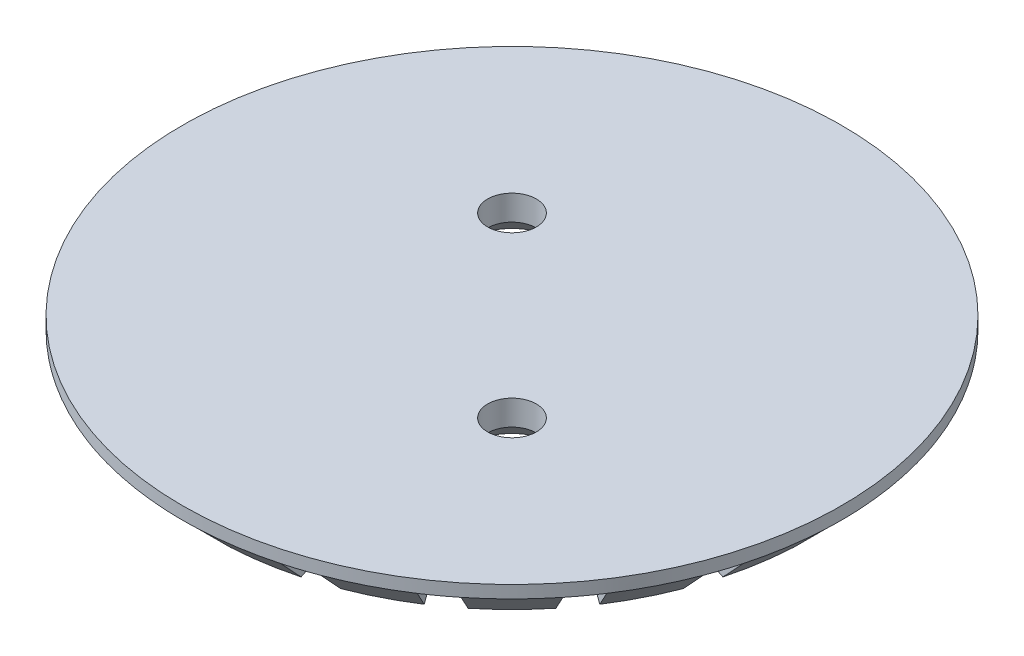
from build123d import *

# Parameters (mm, degrees)
SKETCH2_R                                         = 21
SKETCH2_R_2                                       = 7.5
BOSS_EXTRUDE1_DEPTH                               = 2.8
CSK_FOR_M2_5_FLAT_HEAD_MACHINE_SCREW1_D           = 3.1
CSK_FOR_M2_5_FLAT_HEAD_MACHINE_SCREW1_CSINK_D     = 5.5
CSK_FOR_M2_5_FLAT_HEAD_MACHINE_SCREW1_CSINK_ANGLE = 90
CHAMFER1_SIZE                                     = 2
CUT_EXTRUDE1_DEPTH                                = 2


with BuildPart() as part:
    # Sketch2 → Boss-Extrude1 (new body)
    # profile 1 of 3: a face of its own
    with BuildSketch(Plane(origin=(0, 0, 0), x_dir=(1, 0, 0), z_dir=(0, 1, 0))):
        with Locations(Location((31.941171231, -2.886996739, 0), (0, 0, 270))):
            Circle(SKETCH2_R)
        with Locations((22.748783076, -12.079384894)):
            Circle(SKETCH2_R_2, mode=Mode.SUBTRACT)
        with Locations((41.133559387, 6.305391417)):
            Circle(SKETCH2_R_2, mode=Mode.SUBTRACT)
    # profile 2 of 3: a face of its own
    with BuildSketch(Plane(origin=(0, 0, 0), x_dir=(1, 0, 0), z_dir=(0, 1, 0))):
        with Locations((22.748783076, -12.079384894)):
            Circle(SKETCH2_R_2)
    # profile 3 of 3: a face of its own
    with BuildSketch(Plane(origin=(0, 0, 0), x_dir=(1, 0, 0), z_dir=(0, 1, 0))):
        with Locations((41.133559387, 6.305391417)):
            Circle(SKETCH2_R_2)
    extrude(amount=BOSS_EXTRUDE1_DEPTH)

    # CSK for M2.5 Flat Head Machine Screw1 (through all)
    with Locations(Plane.XZ):
        with Locations((26.284316982, -2.769857511), (37.598025481, 8.543850988)):
            CounterSinkHole(CSK_FOR_M2_5_FLAT_HEAD_MACHINE_SCREW1_D / 2, CSK_FOR_M2_5_FLAT_HEAD_MACHINE_SCREW1_CSINK_D / 2, counter_sink_angle=CSK_FOR_M2_5_FLAT_HEAD_MACHINE_SCREW1_CSINK_ANGLE)

    # Chamfer1
    chamfer1_edges = [part.edges().sort_by_distance(p)[0] for p in [
        (31.941171231, 0, -18.113003261),
    ]]
    chamfer(chamfer1_edges, length=CHAMFER1_SIZE)

    # Sketch5 → Cut-Extrude1 (cut)
    with BuildSketch(Plane.XZ):
        with BuildLine():
            Line((19.291076579, -0.171805949), (13.587125587, -2.025131973))
            ThreePointArc((13.587125587, -2.025131973), (13.871097422, -2.984326154), (14.205159576, -3.927245005))
            Line((14.205159576, -3.927245005), (19.909110568, -2.073918981))
            Line((19.909110568, -2.073918981), (19.291076579, -0.171805949))
        make_face()
        with BuildLine():
            Line((20.855438294, -3.931191717), (16.003367771, -7.456427301))
            ThreePointArc((16.003367771, -7.456427301), (16.569848338, -8.280923055), (17.178938276, -9.07446129))
            Line((17.178938276, -9.07446129), (22.031008798, -5.549225706))
            Line((22.031008798, -5.549225706), (20.855438294, -3.931191717))
        make_face()
        with BuildLine():
            Line((23.504948787, -7.023165694), (19.979713203, -11.875236217))
            ThreePointArc((19.979713203, -11.875236217), (20.773251438, -12.484326154), (21.597747192, -13.050806722))
            Line((21.597747192, -13.050806722), (25.122982776, -8.198736199))
            Line((25.122982776, -8.198736199), (23.504948787, -7.023165694))
        make_face()
        with BuildLine():
            Line((19.979713203, -11.875236217), (18.802666769, -13.495301649))
            ThreePointArc((18.802666769, -13.495301649), (19.597680933, -14.102360143), (20.420700757, -14.670872154))
            Line((20.420700757, -14.670872154), (21.597747192, -13.050806722))
            ThreePointArc((21.597747192, -13.050806722), (20.773251438, -12.484326154), (19.979713203, -11.875236217))
        make_face()
        with BuildLine():
            Line((25.126929488, -14.849014917), (24.508119556, -16.753516055))
            ThreePointArc((24.508119556, -16.753516055), (25.45181435, -17.085190104), (26.410232589, -17.371550044))
            Line((26.410232589, -17.371550044), (27.02904252, -15.467048906))
            ThreePointArc((27.02904252, -15.467048906), (26.069848338, -15.183077071), (25.126929488, -14.849014917))
        make_face()
        with BuildLine():
            Line((26.980255511, -9.145063925), (25.126929488, -14.849014917))
            ThreePointArc((25.126929488, -14.849014917), (26.069848338, -15.183077071), (27.02904252, -15.467048906))
            Line((27.02904252, -15.467048906), (28.882368544, -9.763097913))
            Line((28.882368544, -9.763097913), (26.980255511, -9.145063925))
        make_face()
        with BuildLine():
            Line((30.941171231, -10.089180225), (30.941171231, -16.086669222))
            ThreePointArc((30.941171231, -16.086669222), (31.941171231, -16.113003261), (32.941171231, -16.086669222))
            Line((32.941171231, -16.086669222), (32.941171231, -10.089180225))
            Line((32.941171231, -10.089180225), (30.941171231, -10.089180225))
        make_face()
        with BuildLine():
            Line((30.941171231, -16.086669222), (30.941171231, -18.089180225))
            ThreePointArc((30.941171231, -18.089180225), (31.941171231, -18.113003261), (32.941171231, -18.089180225))
            Line((32.941171231, -18.089180225), (32.941171231, -16.086669222))
            ThreePointArc((32.941171231, -16.086669222), (31.941171231, -16.113003261), (30.941171231, -16.086669222))
        make_face()
        with BuildLine():
            ThreePointArc((36.853299943, -15.467048906), (37.812494125, -15.183077071), (38.755412975, -14.849014917))
            Line((38.755412975, -14.849014917), (36.902086951, -9.145063925))
            Line((36.902086951, -9.145063925), (34.999973919, -9.763097913))
            Line((34.999973919, -9.763097913), (36.853299943, -15.467048906))
        make_face()
        with BuildLine():
            ThreePointArc((37.472109874, -17.371550044), (38.430528113, -17.085190104), (39.374222906, -16.753516055))
            Line((39.374222906, -16.753516055), (38.755412975, -14.849014917))
            ThreePointArc((38.755412975, -14.849014917), (37.812494125, -15.183077071), (36.853299943, -15.467048906))
            Line((36.853299943, -15.467048906), (37.472109874, -17.371550044))
        make_face()
        with BuildLine():
            ThreePointArc((42.284595271, -13.050806722), (43.109091025, -12.484326154), (43.90262926, -11.875236217))
            Line((43.90262926, -11.875236217), (40.377393676, -7.023165694))
            Line((40.377393676, -7.023165694), (38.759359687, -8.198736199))
            Line((38.759359687, -8.198736199), (42.284595271, -13.050806722))
        make_face()
        with BuildLine():
            ThreePointArc((43.461641706, -14.670872154), (44.28466153, -14.102360143), (45.079675694, -13.495301649))
            Line((45.079675694, -13.495301649), (43.90262926, -11.875236217))
            ThreePointArc((43.90262926, -11.875236217), (43.109091025, -12.484326154), (42.284595271, -13.050806722))
            Line((42.284595271, -13.050806722), (43.461641706, -14.670872154))
        make_face()
        with BuildLine():
            ThreePointArc((46.703404187, -9.07446129), (47.312494125, -8.280923055), (47.878974692, -7.456427301))
            Line((47.878974692, -7.456427301), (43.026904169, -3.931191717))
            Line((43.026904169, -3.931191717), (41.851333665, -5.549225706))
            Line((41.851333665, -5.549225706), (46.703404187, -9.07446129))
        make_face()
        with BuildLine():
            ThreePointArc((48.32346962, -10.251507724), (48.930528113, -9.456493559), (49.499040124, -8.633473736))
            Line((49.499040124, -8.633473736), (47.878974692, -7.456427301))
            ThreePointArc((47.878974692, -7.456427301), (47.312494125, -8.280923055), (46.703404187, -9.07446129))
            Line((46.703404187, -9.07446129), (48.32346962, -10.251507724))
        make_face()
        with BuildLine():
            ThreePointArc((49.677182887, -3.927245005), (50.011245041, -2.984326154), (50.295216876, -2.025131973))
            Line((50.295216876, -2.025131973), (44.591265883, -0.171805949))
            Line((44.591265883, -0.171805949), (43.973231895, -2.073918981))
            Line((43.973231895, -2.073918981), (49.677182887, -3.927245005))
        make_face()
        with BuildLine():
            ThreePointArc((51.581684025, -4.546054936), (51.913358074, -3.602360143), (52.199718014, -2.643941904))
            Line((52.199718014, -2.643941904), (50.295216876, -2.025131973))
            ThreePointArc((50.295216876, -2.025131973), (50.011245041, -2.984326154), (49.677182887, -3.927245005))
            Line((49.677182887, -3.927245005), (51.581684025, -4.546054936))
        make_face()
        with BuildLine():
            ThreePointArc((52.941171231, 2.886996739), (52.935214628, 3.387138603), (52.917348195, 3.886996739))
            Line((52.917348195, 3.886996739), (50.914837192, 3.886996739))
            ThreePointArc((50.914837192, 3.886996739), (50.934586581, 3.387170079), (50.941171231, 2.886996739))
            ThreePointArc((50.941171231, 2.886996739), (50.934586581, 2.386823398), (50.914837192, 1.886996739))
            Line((50.914837192, 1.886996739), (52.917348195, 1.886996739))
            ThreePointArc((52.917348195, 1.886996739), (52.935214628, 2.386854875), (52.941171231, 2.886996739))
        make_face()
        with BuildLine():
            ThreePointArc((50.941171231, 2.886996739), (50.934586581, 3.387170079), (50.914837192, 3.886996739))
            Line((50.914837192, 3.886996739), (44.917348195, 3.886996739))
            Line((44.917348195, 3.886996739), (44.917348195, 1.886996739))
            Line((44.917348195, 1.886996739), (50.914837192, 1.886996739))
            ThreePointArc((50.914837192, 1.886996739), (50.934586581, 2.386823398), (50.941171231, 2.886996739))
        make_face()
        with BuildLine():
            ThreePointArc((52.199718014, 8.417935381), (51.913358074, 9.376353621), (51.581684025, 10.320048414))
            Line((51.581684025, 10.320048414), (49.677182887, 9.701238483))
            ThreePointArc((49.677182887, 9.701238483), (50.011245041, 8.758319632), (50.295216876, 7.79912545))
            Line((50.295216876, 7.79912545), (52.199718014, 8.417935381))
        make_face()
        with BuildLine():
            ThreePointArc((50.295216876, 7.79912545), (50.011245041, 8.758319632), (49.677182887, 9.701238483))
            Line((49.677182887, 9.701238483), (43.973231895, 7.847912459))
            Line((43.973231895, 7.847912459), (44.591265883, 5.945799426))
            Line((44.591265883, 5.945799426), (50.295216876, 7.79912545))
        make_face()
        with BuildLine():
            ThreePointArc((49.499040124, 14.407467213), (48.930528113, 15.230487037), (48.32346962, 16.025501202))
            Line((48.32346962, 16.025501202), (46.703404187, 14.848454767))
            ThreePointArc((46.703404187, 14.848454767), (47.312494125, 14.054916532), (47.878974692, 13.230420778))
            Line((47.878974692, 13.230420778), (49.499040124, 14.407467213))
        make_face()
        with BuildLine():
            ThreePointArc((47.878974692, 13.230420778), (47.312494125, 14.054916532), (46.703404187, 14.848454767))
            Line((46.703404187, 14.848454767), (41.851333665, 11.323219183))
            Line((41.851333665, 11.323219183), (43.026904169, 9.705185195))
            Line((43.026904169, 9.705185195), (47.878974692, 13.230420778))
        make_face()
        with BuildLine():
            ThreePointArc((45.079675694, 19.269295127), (44.28466153, 19.876353621), (43.461641706, 20.444865631))
            Line((43.461641706, 20.444865631), (42.284595271, 18.824800199))
            ThreePointArc((42.284595271, 18.824800199), (43.109091025, 18.258319632), (43.90262926, 17.649229694))
            Line((43.90262926, 17.649229694), (45.079675694, 19.269295127))
        make_face()
        with BuildLine():
            ThreePointArc((43.90262926, 17.649229694), (43.109091025, 18.258319632), (42.284595271, 18.824800199))
            Line((42.284595271, 18.824800199), (38.759359687, 13.972729676))
            Line((38.759359687, 13.972729676), (40.377393676, 12.797159172))
            Line((40.377393676, 12.797159172), (43.90262926, 17.649229694))
        make_face()
        with BuildLine():
            ThreePointArc((39.374222906, 22.527509532), (38.430528113, 22.859183581), (37.472109874, 23.145543521))
            Line((37.472109874, 23.145543521), (36.853299943, 21.241042383))
            ThreePointArc((36.853299943, 21.241042383), (37.812494125, 20.957070548), (38.755412975, 20.623008395))
            Line((38.755412975, 20.623008395), (39.374222906, 22.527509532))
        make_face()
        with BuildLine():
            ThreePointArc((38.755412975, 20.623008395), (37.812494125, 20.957070548), (36.853299943, 21.241042383))
            Line((36.853299943, 21.241042383), (34.999973919, 15.537091391))
            Line((34.999973919, 15.537091391), (36.902086951, 14.919057402))
            Line((36.902086951, 14.919057402), (38.755412975, 20.623008395))
        make_face()
        with BuildLine():
            ThreePointArc((32.941171231, 23.863173702), (32.441313096, 23.881040135), (31.941171231, 23.886996739))
            Line((31.941171231, 23.886996739), (31.941171231, 21.886996739))
            ThreePointArc((31.941171231, 21.886996739), (32.441344572, 21.880412088), (32.941171231, 21.8606627))
            Line((32.941171231, 21.8606627), (32.941171231, 23.863173702))
        make_face()
        with BuildLine():
            Line((31.941171231, 21.886996739), (31.941171231, 23.886996739))
            ThreePointArc((31.941171231, 23.886996739), (31.441029367, 23.881040135), (30.941171231, 23.863173702))
            Line((30.941171231, 23.863173702), (30.941171231, 21.8606627))
            ThreePointArc((30.941171231, 21.8606627), (31.440997891, 21.880412088), (31.941171231, 21.886996739))
        make_face()
        with BuildLine():
            ThreePointArc((32.941171231, 21.8606627), (32.441344572, 21.880412088), (31.941171231, 21.886996739))
            Line((31.941171231, 21.886996739), (31.941171231, 15.863173702))
            Line((31.941171231, 15.863173702), (32.941171231, 15.863173702))
            Line((32.941171231, 15.863173702), (32.941171231, 21.8606627))
        make_face()
        with BuildLine():
            Line((31.941171231, 15.863173702), (31.941171231, 21.886996739))
            ThreePointArc((31.941171231, 21.886996739), (31.440997891, 21.880412088), (30.941171231, 21.8606627))
            Line((30.941171231, 21.8606627), (30.941171231, 15.863173702))
            Line((30.941171231, 15.863173702), (31.941171231, 15.863173702))
        make_face()
        with BuildLine():
            Line((28.882368544, 15.537091391), (27.02904252, 21.241042383))
            ThreePointArc((27.02904252, 21.241042383), (26.069848338, 20.957070548), (25.126929488, 20.623008395))
            Line((25.126929488, 20.623008395), (26.980255511, 14.919057402))
            Line((26.980255511, 14.919057402), (28.882368544, 15.537091391))
        make_face()
        with BuildLine():
            Line((27.02904252, 21.241042383), (26.410232589, 23.145543521))
            ThreePointArc((26.410232589, 23.145543521), (25.45181435, 22.859183581), (24.508119556, 22.527509532))
            Line((24.508119556, 22.527509532), (25.126929488, 20.623008395))
            ThreePointArc((25.126929488, 20.623008395), (26.069848338, 20.957070548), (27.02904252, 21.241042383))
        make_face()
        with BuildLine():
            Line((21.597747192, 18.824800199), (20.420700757, 20.444865631))
            ThreePointArc((20.420700757, 20.444865631), (19.597680933, 19.876353621), (18.802666769, 19.269295127))
            Line((18.802666769, 19.269295127), (19.979713203, 17.649229694))
            ThreePointArc((19.979713203, 17.649229694), (20.773251438, 18.258319632), (21.597747192, 18.824800199))
        make_face()
        with BuildLine():
            Line((25.122982776, 13.972729676), (21.597747192, 18.824800199))
            ThreePointArc((21.597747192, 18.824800199), (20.773251438, 18.258319632), (19.979713203, 17.649229694))
            Line((19.979713203, 17.649229694), (23.504948787, 12.797159172))
            Line((23.504948787, 12.797159172), (25.122982776, 13.972729676))
        make_face()
        with BuildLine():
            Line((17.178938276, 14.848454767), (15.558872843, 16.025501202))
            ThreePointArc((15.558872843, 16.025501202), (14.95181435, 15.230487037), (14.383302339, 14.407467213))
            Line((14.383302339, 14.407467213), (16.003367771, 13.230420778))
            ThreePointArc((16.003367771, 13.230420778), (16.569848338, 14.054916532), (17.178938276, 14.848454767))
        make_face()
        with BuildLine():
            Line((22.031008798, 11.323219183), (17.178938276, 14.848454767))
            ThreePointArc((17.178938276, 14.848454767), (16.569848338, 14.054916532), (16.003367771, 13.230420778))
            Line((16.003367771, 13.230420778), (20.855438294, 9.705185195))
            Line((20.855438294, 9.705185195), (22.031008798, 11.323219183))
        make_face()
        with BuildLine():
            Line((14.205159576, 9.701238483), (12.300658438, 10.320048414))
            ThreePointArc((12.300658438, 10.320048414), (11.968984389, 9.376353621), (11.682624449, 8.417935381))
            Line((11.682624449, 8.417935381), (13.587125587, 7.79912545))
            ThreePointArc((13.587125587, 7.79912545), (13.871097422, 8.758319632), (14.205159576, 9.701238483))
        make_face()
        with BuildLine():
            Line((19.909110568, 7.847912459), (14.205159576, 9.701238483))
            ThreePointArc((14.205159576, 9.701238483), (13.871097422, 8.758319632), (13.587125587, 7.79912545))
            Line((13.587125587, 7.79912545), (19.291076579, 5.945799426))
            Line((19.291076579, 5.945799426), (19.909110568, 7.847912459))
        make_face()
        with BuildLine():
            Line((12.96750527, 3.886996739), (10.964994268, 3.886996739))
            ThreePointArc((10.964994268, 3.886996739), (10.941171231, 2.886996739), (10.964994268, 1.886996739))
            Line((10.964994268, 1.886996739), (12.96750527, 1.886996739))
            ThreePointArc((12.96750527, 1.886996739), (12.941171231, 2.886996739), (12.96750527, 3.886996739))
        make_face()
        with BuildLine():
            Line((18.964994268, 3.886996739), (12.96750527, 3.886996739))
            ThreePointArc((12.96750527, 3.886996739), (12.941171231, 2.886996739), (12.96750527, 1.886996739))
            Line((12.96750527, 1.886996739), (18.964994268, 1.886996739))
            Line((18.964994268, 1.886996739), (18.964994268, 3.886996739))
        make_face()
        with BuildLine():
            Line((13.587125587, -2.025131973), (11.682624449, -2.643941904))
            ThreePointArc((11.682624449, -2.643941904), (11.968984389, -3.602360143), (12.300658438, -4.546054936))
            Line((12.300658438, -4.546054936), (14.205159576, -3.927245005))
            ThreePointArc((14.205159576, -3.927245005), (13.871097422, -2.984326154), (13.587125587, -2.025131973))
        make_face()
        with BuildLine():
            Line((16.003367771, -7.456427301), (14.383302339, -8.633473736))
            ThreePointArc((14.383302339, -8.633473736), (14.95181435, -9.456493559), (15.558872843, -10.251507724))
            Line((15.558872843, -10.251507724), (17.178938276, -9.07446129))
            ThreePointArc((17.178938276, -9.07446129), (16.569848338, -8.280923055), (16.003367771, -7.456427301))
        make_face()
    extrude(amount=-CUT_EXTRUDE1_DEPTH, mode=Mode.SUBTRACT)


solid = part.part
